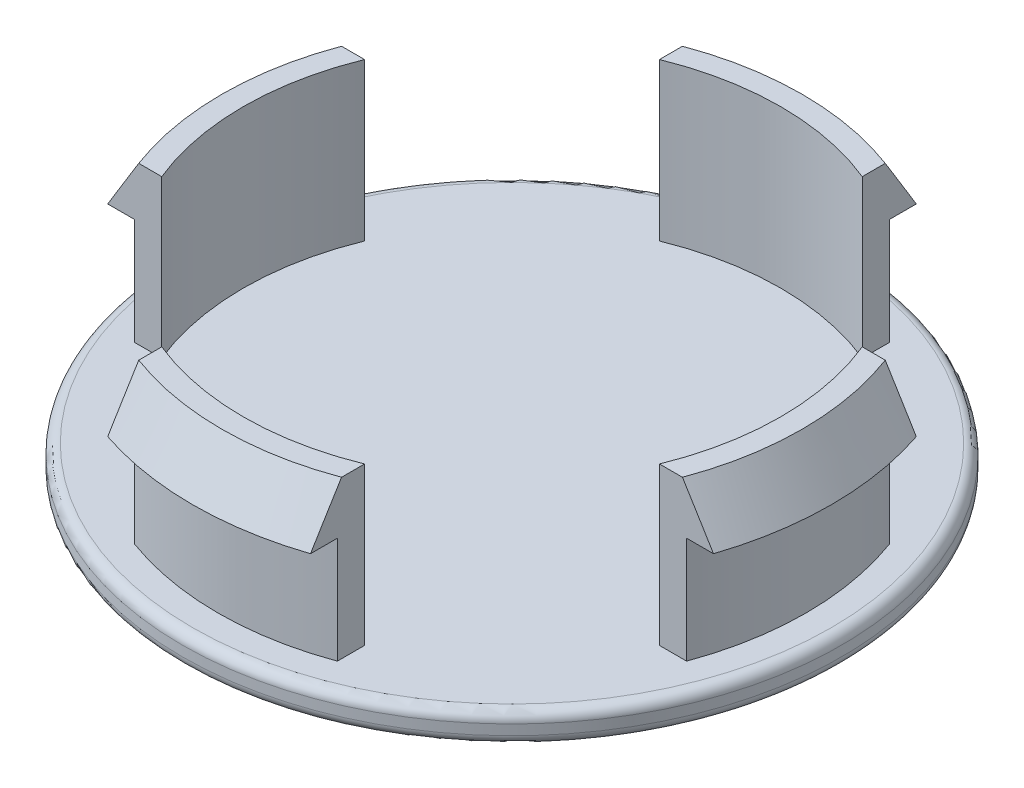
from build123d import *

# Parameters (mm, degrees)
CUT_EXTRUDE_1_REACH = 51.545


with BuildPart() as part:
    # Эскиз1 → Повернуть1 (revolve)
    with BuildSketch(Plane.XY, mode=Mode.PRIVATE) as revolve_1_sk:
        with BuildLine():
            Line((0, 0), (-31.5, 0))
            ThreePointArc((-31.5, 0), (-32.207106781, 0.292893219), (-32.5, 1))
            Line((-32.5, 1), (-32.5, 2))
            ThreePointArc((-32.5, 2), (-32.207106781, 2.707106781), (-31.5, 3))
            Line((-31.5, 3), (-29, 3))
            Line((-29, 3), (-29, 13.5))
            Line((-29, 13.5), (-31.5, 13.5))
            Line((-31.5, 13.5), (-28.613248654, 18.5))
            Line((-28.613248654, 18.5), (-26.5, 18.5))
            Line((-26.5, 18.5), (-26.5, 3))
            Line((-26.5, 3), (0, 3))
            Line((0, 3), (0, 0))
        make_face()
    revolve(revolve_1_sk.sketch.rotate(Axis((0, 0, 0), (0, -1, 0)), 270), axis=Axis((0, 0, 0), (0, -1, 0)))

    # Вырез-Вытянуть1: up to this face of the body (flat: up to its plane)
    cut_extrude_1_end = Plane(part.part.faces().sort_by_distance((0, 3, -30.609045456))[0])
    # Эскиз2 → Вырез-Вытянуть1 (cut, up to the picked face)
    with BuildSketch(Plane(origin=(0, 18.5, 0), x_dir=(1, 0, 0), z_dir=(0, 1, 0)), mode=Mode.PRIVATE) as cut_extrude_1_sk1:
        with BuildLine():
            Line((-10, 26.8089164), (-10, 40.856644609))
            ThreePointArc((-10, 40.856644609), (-29.742775667, 29.742775667), (-40.856644609, 10))
            Line((-40.856644609, 10), (-26.8089164, 10))
            ThreePointArc((-26.8089164, 10), (-20.232622155, 20.232622155), (-10, 26.8089164))
        make_face()
    cut_extrude_1_tool1 = split(extrude(cut_extrude_1_sk1.sketch, amount=-CUT_EXTRUDE_1_REACH, mode=Mode.PRIVATE), bisect_by=cut_extrude_1_end, keep=Keep.BOTH, mode=Mode.PRIVATE)
    # Эскиз2 → Вырез-Вытянуть1 (cut, up to the picked face)
    with BuildSketch(Plane(origin=(0, 18.5, 0), x_dir=(1, 0, 0), z_dir=(0, 1, 0)), mode=Mode.PRIVATE) as cut_extrude_1_sk2:
        with BuildLine():
            ThreePointArc((26.8089164, 10), (20.232622155, 20.232622155), (10, 26.8089164))
            Line((10, 26.8089164), (10, 24.540782384))
            ThreePointArc((10, 24.540782384), (18.738329701, 18.738329701), (24.540782384, 10))
            Line((24.540782384, 10), (26.8089164, 10))
        make_face()
    cut_extrude_1_tool2 = split(extrude(cut_extrude_1_sk2.sketch, amount=-CUT_EXTRUDE_1_REACH, mode=Mode.PRIVATE), bisect_by=cut_extrude_1_end, keep=Keep.BOTH, mode=Mode.PRIVATE)
    # Эскиз2 → Вырез-Вытянуть1 (cut, up to the picked face)
    with BuildSketch(Plane(origin=(0, 18.5, 0), x_dir=(1, 0, 0), z_dir=(0, 1, 0)), mode=Mode.PRIVATE) as cut_extrude_1_sk3:
        with BuildLine():
            ThreePointArc((40.856644609, 10), (29.742775667, 29.742775667), (10, 40.856644609))
            Line((10, 40.856644609), (10, 26.8089164))
            ThreePointArc((10, 26.8089164), (20.232622155, 20.232622155), (26.8089164, 10))
            Line((26.8089164, 10), (40.856644609, 10))
        make_face()
    cut_extrude_1_tool3 = split(extrude(cut_extrude_1_sk3.sketch, amount=-CUT_EXTRUDE_1_REACH, mode=Mode.PRIVATE), bisect_by=cut_extrude_1_end, keep=Keep.BOTH, mode=Mode.PRIVATE)
    # Эскиз2 → Вырез-Вытянуть1 (cut, up to the picked face)
    with BuildSketch(Plane(origin=(0, 18.5, 0), x_dir=(1, 0, 0), z_dir=(0, 1, 0)), mode=Mode.PRIVATE) as cut_extrude_1_sk4:
        with BuildLine():
            ThreePointArc((10, -40.856644609), (29.742775667, -29.742775667), (40.856644609, -10))
            Line((40.856644609, -10), (26.8089164, -10))
            ThreePointArc((26.8089164, -10), (20.232622155, -20.232622155), (10, -26.8089164))
            Line((10, -26.8089164), (10, -40.856644609))
        make_face()
    cut_extrude_1_tool4 = split(extrude(cut_extrude_1_sk4.sketch, amount=-CUT_EXTRUDE_1_REACH, mode=Mode.PRIVATE), bisect_by=cut_extrude_1_end, keep=Keep.BOTH, mode=Mode.PRIVATE)
    # Эскиз2 → Вырез-Вытянуть1 (cut, up to the picked face)
    with BuildSketch(Plane(origin=(0, 18.5, 0), x_dir=(1, 0, 0), z_dir=(0, 1, 0)), mode=Mode.PRIVATE) as cut_extrude_1_sk5:
        with BuildLine():
            ThreePointArc((10, -26.8089164), (20.232622155, -20.232622155), (26.8089164, -10))
            Line((26.8089164, -10), (24.540782384, -10))
            ThreePointArc((24.540782384, -10), (18.738329701, -18.738329701), (10, -24.540782384))
            Line((10, -24.540782384), (10, -26.8089164))
        make_face()
    cut_extrude_1_tool5 = split(extrude(cut_extrude_1_sk5.sketch, amount=-CUT_EXTRUDE_1_REACH, mode=Mode.PRIVATE), bisect_by=cut_extrude_1_end, keep=Keep.BOTH, mode=Mode.PRIVATE)
    # Эскиз2 → Вырез-Вытянуть1 (cut, up to the picked face)
    with BuildSketch(Plane(origin=(0, 18.5, 0), x_dir=(1, 0, 0), z_dir=(0, 1, 0)), mode=Mode.PRIVATE) as cut_extrude_1_sk6:
        with BuildLine():
            Line((-26.8089164, -10), (-40.856644609, -10))
            ThreePointArc((-40.856644609, -10), (-29.742775667, -29.742775667), (-10, -40.856644609))
            Line((-10, -40.856644609), (-10, -26.8089164))
            ThreePointArc((-10, -26.8089164), (-20.232622155, -20.232622155), (-26.8089164, -10))
        make_face()
    cut_extrude_1_tool6 = split(extrude(cut_extrude_1_sk6.sketch, amount=-CUT_EXTRUDE_1_REACH, mode=Mode.PRIVATE), bisect_by=cut_extrude_1_end, keep=Keep.BOTH, mode=Mode.PRIVATE)
    # Эскиз2 → Вырез-Вытянуть1 (cut, up to the picked face)
    with BuildSketch(Plane(origin=(0, 18.5, 0), x_dir=(1, 0, 0), z_dir=(0, 1, 0)), mode=Mode.PRIVATE) as cut_extrude_1_sk7:
        with BuildLine():
            Line((-24.540782384, -10), (-26.8089164, -10))
            ThreePointArc((-26.8089164, -10), (-20.232622155, -20.232622155), (-10, -26.8089164))
            Line((-10, -26.8089164), (-10, -24.540782384))
            ThreePointArc((-10, -24.540782384), (-18.738329701, -18.738329701), (-24.540782384, -10))
        make_face()
    cut_extrude_1_tool7 = split(extrude(cut_extrude_1_sk7.sketch, amount=-CUT_EXTRUDE_1_REACH, mode=Mode.PRIVATE), bisect_by=cut_extrude_1_end, keep=Keep.BOTH, mode=Mode.PRIVATE)
    # Эскиз2 → Вырез-Вытянуть1 (cut, up to the picked face)
    with BuildSketch(Plane(origin=(0, 18.5, 0), x_dir=(1, 0, 0), z_dir=(0, 1, 0)), mode=Mode.PRIVATE) as cut_extrude_1_sk8:
        with BuildLine():
            Line((-10, 24.540782384), (-10, 26.8089164))
            ThreePointArc((-10, 26.8089164), (-20.232622155, 20.232622155), (-26.8089164, 10))
            Line((-26.8089164, 10), (-24.540782384, 10))
            ThreePointArc((-24.540782384, 10), (-18.738329701, 18.738329701), (-10, 24.540782384))
        make_face()
    cut_extrude_1_tool8 = split(extrude(cut_extrude_1_sk8.sketch, amount=-CUT_EXTRUDE_1_REACH, mode=Mode.PRIVATE), bisect_by=cut_extrude_1_end, keep=Keep.BOTH, mode=Mode.PRIVATE)
    add(cut_extrude_1_tool1.solids().sort_by(Axis((-24.400112, 18.5, -24.400112), (0, -1, 0)))[0], mode=Mode.SUBTRACT)
    add(cut_extrude_1_tool2.solids().sort_by(Axis((18.950359, 18.5, -18.950359), (0, -1, 0)))[0], mode=Mode.SUBTRACT)
    add(cut_extrude_1_tool3.solids().sort_by(Axis((24.400112, 18.5, -24.400112), (0, -1, 0)))[0], mode=Mode.SUBTRACT)
    add(cut_extrude_1_tool4.solids().sort_by(Axis((24.400112, 18.5, 24.400112), (0, -1, 0)))[0], mode=Mode.SUBTRACT)
    add(cut_extrude_1_tool5.solids().sort_by(Axis((18.950359, 18.5, 18.950359), (0, -1, 0)))[0], mode=Mode.SUBTRACT)
    add(cut_extrude_1_tool6.solids().sort_by(Axis((-24.400112, 18.5, 24.400112), (0, -1, 0)))[0], mode=Mode.SUBTRACT)
    add(cut_extrude_1_tool7.solids().sort_by(Axis((-18.950359, 18.5, 18.950359), (0, -1, 0)))[0], mode=Mode.SUBTRACT)
    add(cut_extrude_1_tool8.solids().sort_by(Axis((-18.950359, 18.5, -18.950359), (0, -1, 0)))[0], mode=Mode.SUBTRACT)


solid = part.part
